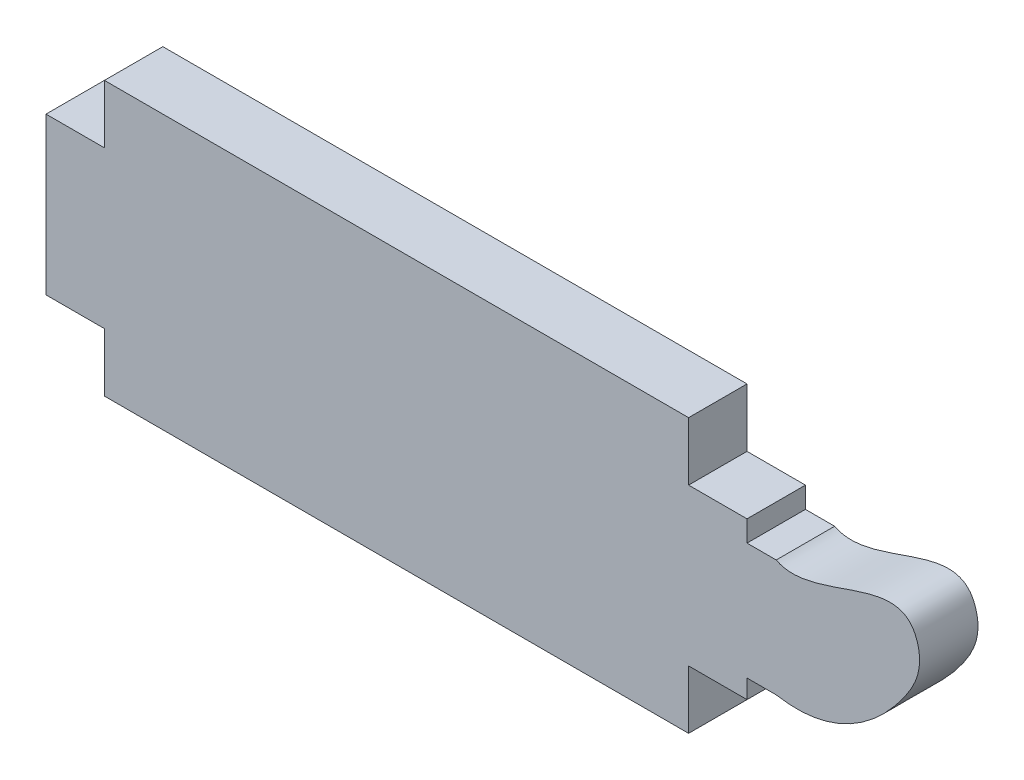
from build123d import *

# Parameters (mm, degrees)
BOSS_EXTRUDE1_DEPTH = 3.175


with BuildPart() as part:
    # Sketch1 → Boss-Extrude1 (new body)
    with BuildSketch(Plane.XY):
        with BuildLine():
            Line((0, 5.639663891), (-31.75, 5.639663891))
            Line((-31.75, 5.639663891), (-31.75, 8.814663891))
            Line((-31.75, 8.814663891), (-34.925, 8.814663891))
            Line((-34.925, 8.814663891), (-34.925, 17.325102195))
            Line((-34.925, 17.325102195), (-31.75, 17.325102195))
            Line((-31.75, 17.325102195), (-31.75, 20.500102195))
            Line((-31.75, 20.500102195), (0, 20.500102195))
            Line((0, 20.500102195), (0, 17.325102195))
            Line((0, 17.325102195), (3.175, 17.325102195))
            Line((3.175, 17.325102195), (3.175, 16.182102195))
            Line((3.175, 16.182102195), (4.7625, 16.182102195))
            add(Edge.make_bspline(
                [(4.7625, 9.832102195), (7.659778086, 9.31714992), (10.728301246, 11.34273023), (12.826116241, 14.945670316), (11.575816546, 19.158870701), (6.71856433, 15.166738189), (4.7625, 16.182102195)],
                knots=[0, 0, 0, 0, 0.407368903, 0.542633112, 0.615483108, 1, 1, 1, 1], degree=3))
            Line((4.7625, 9.832102195), (3.175, 9.832102195))
            Line((3.175, 9.832102195), (3.175, 8.814663891))
            Line((3.175, 8.814663891), (0, 8.814663891))
            Line((0, 8.814663891), (0, 5.639663891))
        make_face()
    extrude(amount=-BOSS_EXTRUDE1_DEPTH)


solid = part.part
